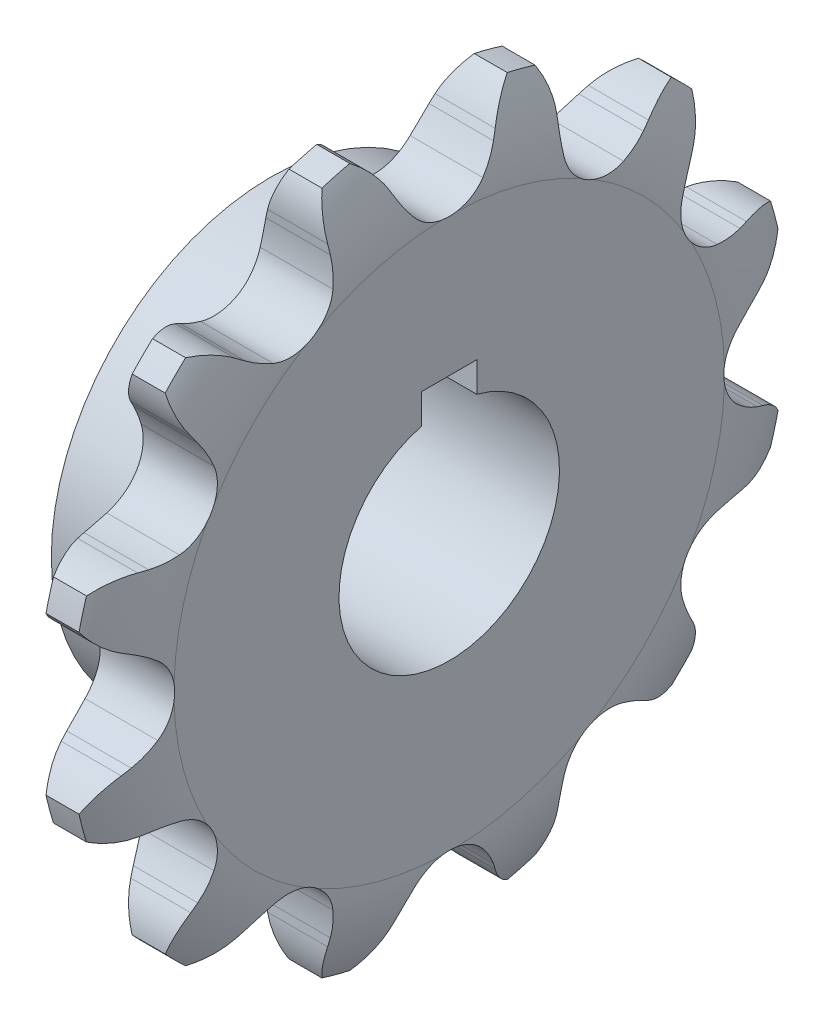
from build123d import *

# Parameters (mm, degrees)
TOOTHCUT_DEPTH   = 30.490680089
TEETHCUTS_COUNT  = 12
TEETHCUTS_ANGLE  = 330
HUBNEAONESKE_R   = 12.630391992
HUBNEARONE_DEPTH = 5.9985148
BORSKE_R         = 6.35
BORE_DEPTH       = 10.2870508
KEYSKE_W         = 3.175
KEYSKE_H         = 7.874
KEYWAY_DEPTH     = 10.2870508


with BuildPart() as part:
    # BasProSke → Base-Revolve (revolve)
    with BuildSketch(Plane(origin=(0, 0, 0), x_dir=(1, 0, 0), z_dir=(0, 1, 0)), mode=Mode.PRIVATE) as base_revolve_sk:
        with BuildLine():
            Line((0, 0), (0, 15.856191992))
            ThreePointArc((0, 15.856191992), (0.302973008, 18.31727374), (1.1938, 20.631391992))
            Line((1.1938, 20.631391992), (3.094736, 20.631391992))
            ThreePointArc((3.094736, 20.631391992), (3.985562992, 18.31727374), (4.288536, 15.856191992))
            Line((4.288536, 15.856191992), (4.288536, 0))
            Line((4.288536, 0), (0, 0))
        make_face()
    revolve(base_revolve_sk.sketch.rotate(Axis((-10, 0, 0), (1, 0, 0)), 180), axis=Axis((-10, 0, 0), (1, 0, 0)))

    # TooCutSke → ToothCut (cut, through all)
    with BuildSketch(Plane(origin=(0, 0, 0), x_dir=(0, 0, -1), z_dir=(1, 0, 0))):
        with BuildLine():
            Line((2.833741878, 18.026507073), (3.058567144, 18.474170984))
            ThreePointArc((3.058567144, 18.474170984), (4.630783806, 20.189944393), (6.869664477, 20.82489082))
            ThreePointArc((6.869664477, 20.82489082), (0, 21.928711036), (-6.869664477, 20.82489082))
            ThreePointArc((-6.869664477, 20.82489082), (-4.630783806, 20.189944393), (-3.058567144, 18.474170984))
            Line((-3.058567144, 18.474170984), (-2.833741878, 18.026507073))
            ThreePointArc((-2.833741878, 18.026507073), (-2.446799671, 17.35630351), (-1.984667943, 16.735552872))
            ThreePointArc((-1.984667943, 16.735552872), (0, 15.810087011), (1.984667943, 16.735552872))
            ThreePointArc((1.984667943, 16.735552872), (2.446799671, 17.35630351), (2.833741878, 18.026507073))
        make_face()
    toothcut = extrude(amount=TOOTHCUT_DEPTH, mode=Mode.SUBTRACT)

    # TeethCuts: ToothCut ×12 about axis
    teethcuts_axis = Axis((-10, 0, 0), (1, 0, 0))
    for i in range(1, TEETHCUTS_COUNT):
        add(toothcut.rotate(teethcuts_axis, i * TEETHCUTS_ANGLE / (TEETHCUTS_COUNT - 1)), mode=Mode.SUBTRACT)

    # HubNeaOneSke → HubNearOne (add)
    with BuildSketch(Plane.ZY):
        with Locations(Location((0, 0, 0), (0, 0, 180))):
            Circle(HUBNEAONESKE_R)
    extrude(amount=HUBNEARONE_DEPTH)

    # BorSke → Bore (cut, symmetric)
    with BuildSketch(Plane(origin=(0, 0, 0), x_dir=(0, 0, -1), z_dir=(1, 0, 0))):
        with Locations(Location((0, 0, 0), (0, 0, 180))):
            Circle(BORSKE_R)
    extrude(amount=BORE_DEPTH, both=True, mode=Mode.SUBTRACT)

    # KeySke → Keyway (cut, symmetric)
    with BuildSketch(Plane(origin=(0, 0, 0), x_dir=(0, 0, -1), z_dir=(1, 0, 0))):
        with Locations((0, 3.937)):
            Rectangle(KEYSKE_W, KEYSKE_H)
    extrude(amount=KEYWAY_DEPTH, both=True, mode=Mode.SUBTRACT)


solid = part.part
